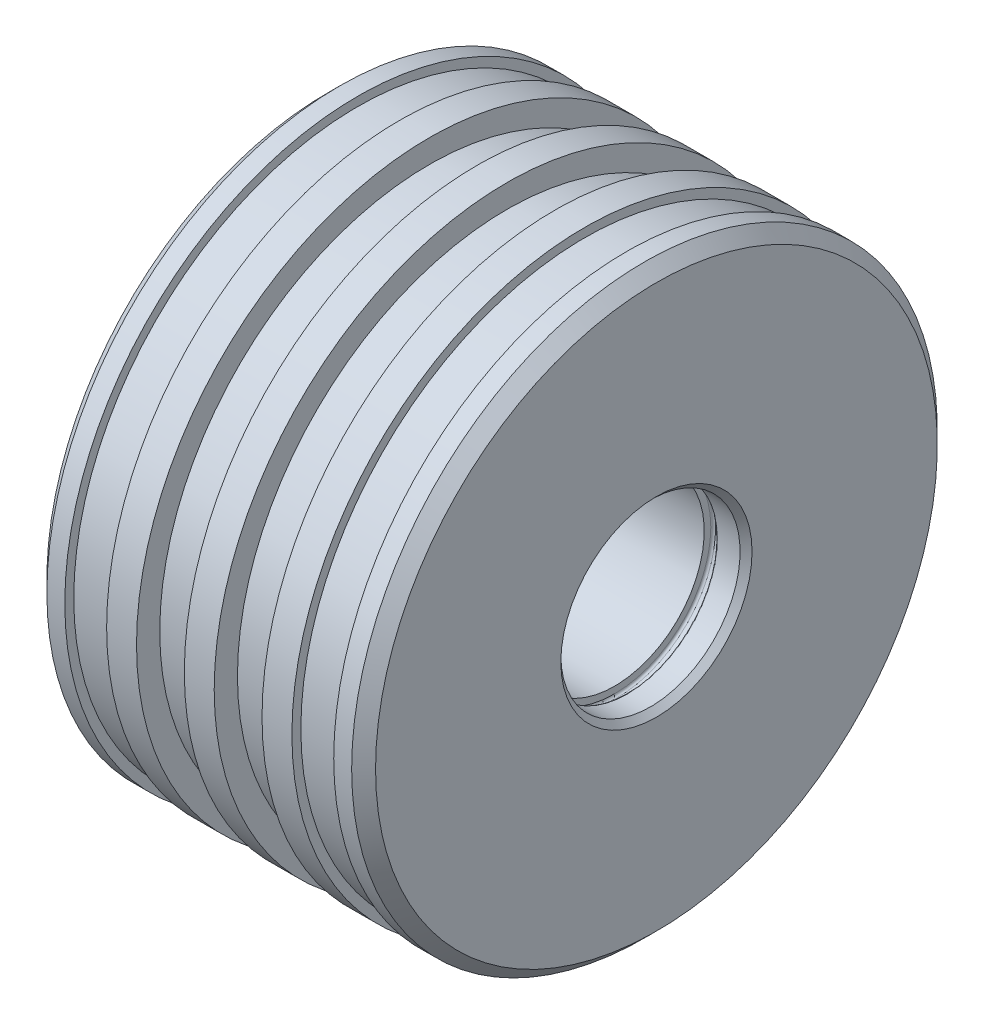
from build123d import *

# Parameters (mm, degrees)
CHAMFER2_SIZE = 2
CHAMFER3_SIZE = 1
FILLET1_R     = 0.4
FILLET2_R     = 0.2


with BuildPart() as part:
    # Sketch3 → Revolve1 (revolve)
    with BuildSketch(Plane.XY, mode=Mode.PRIVATE) as revolve1_sk:
        Polygon((-27.5, 0), (-22.5, 0), (-22.5, 1.5), (-20.5, 1.5), (-20.5, 0), (-1, 0), (-1, 1.5), (1, 1.5), (1, 0), (20.5, 0), (20.5, 1.5), (22.5, 1.5), (22.5, 0), (27.5, 0), (27.5, 30.11), (27.5, 34), (22.5, 34), (22.5, 32.5), (15.5, 32.5), (15.5, 34), (10.5, 34), (10.5, 30.11), (2.5, 30.11), (2.5, 34), (-2.5, 34), (-2.5, 30.11), (-10.5, 30.11), (-10.5, 34), (-15.5, 34), (-15.5, 32.5), (-22.5, 32.5), (-22.5, 34), (-27.5, 34), (-27.5, 30.11), align=None)
    revolve(revolve1_sk.sketch.rotate(Axis((-27.5, -15, 0), (1, 0, 0)), 90), axis=Axis((-27.5, -15, 0), (1, 0, 0)))

    # Chamfer2
    chamfer2_edges = [part.edges().sort_by_distance(p)[0] for p in [
        (27.5, -15, -49),
        (-27.5, -15, -49),
    ]]
    chamfer(chamfer2_edges, length=CHAMFER2_SIZE)

    # Chamfer3
    chamfer3_edges = [part.edges().sort_by_distance(p)[0] for p in [
        (-27.5, -15, -15),
        (27.5, -15, -15),
    ]]
    chamfer(chamfer3_edges, length=CHAMFER3_SIZE)

    # Fillet1
    fillet1_edges = [part.edges().sort_by_distance(p)[0] for p in [
        (-22.5, -15, -16.5),
        (-1, -15, -16.5),
        (20.5, -15, -16.5),
    ]]
    fillet(fillet1_edges, radius=FILLET1_R)

    # Fillet2
    fillet2_edges = [part.edges().sort_by_distance(p)[0] for p in [
        (-20.5, -15, -15),
        (1, -15, -15),
        (22.5, -15, -15),
    ]]
    fillet(fillet2_edges, radius=FILLET2_R)


solid = part.part
